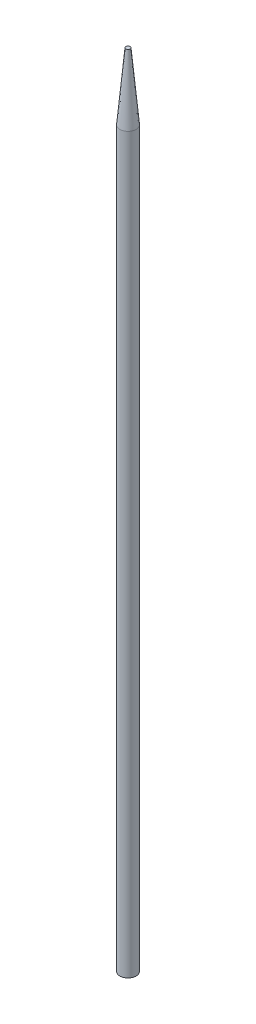
from build123d import *


with BuildPart() as part:
    # Sketch1 → Revolve1 (revolve)
    with BuildSketch(Plane(origin=(0, 0, 0), x_dir=(0, 0, -1), z_dir=(1, 0, 0))):
        Polygon((0, 0), (0, 152.4), (0.4064, 152.4), (1.5494, 139.7), (1.5494, 0), align=None)
    revolve(axis=Axis((0, 0, 0), (0, 1, 0)))


solid = part.part
